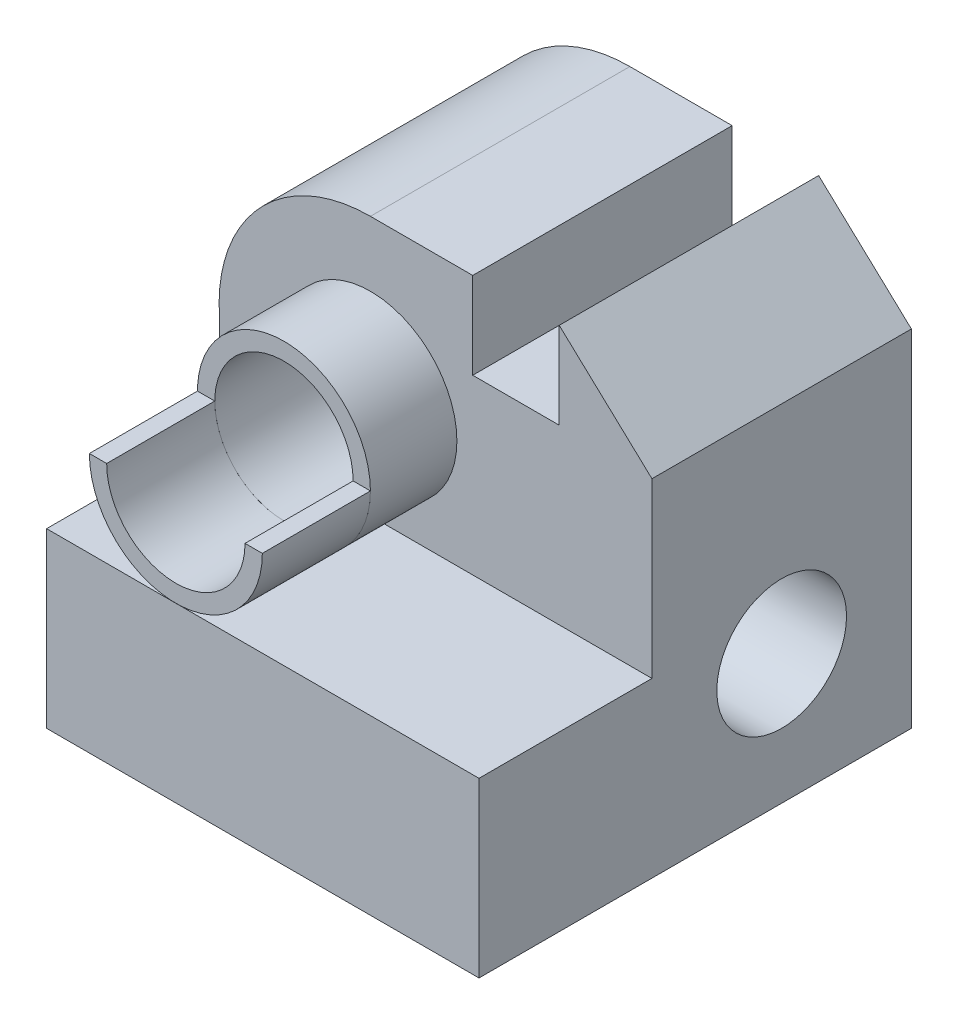
from build123d import *

# Parameters (mm, degrees)
SKETCH1_W           = 63.5
SKETCH1_H           = 25.4
BOSS_EXTRUDE1_DEPTH = 63.5
BOSS_EXTRUDE2_DEPTH = 38.1
BOSS_EXTRUDE3_DEPTH = 12.7
BOSS_EXTRUDE4_DEPTH = 15.875
SKETCH5_R           = 10.16
CUT_EXTRUDE1_DEPTH  = 84.027885603
SKETCH6_R           = 9.525
CUT_EXTRUDE2_DEPTH  = 111.026122617


with BuildPart() as part:
    # Sketch1 → Boss-Extrude1 (new body)
    with BuildSketch(Plane.XY):
        with Locations((5.796901173, 12.7)):
            Rectangle(SKETCH1_W, SKETCH1_H)
    extrude(amount=-BOSS_EXTRUDE1_DEPTH)

    # Sketch2 → Boss-Extrude2 (add)
    with BuildSketch(Plane(origin=(0, 0, -63.5), x_dir=(-1, 0, 0), z_dir=(0, 0, -1))):
        with BuildLine():
            Line((-37.546901173, 25.4), (-37.546901173, 50.8))
            Line((-37.546901173, 50.8), (-23.927818555, 63.5))
            Line((-23.927818555, 63.5), (-23.927818555, 50.8))
            Line((-23.927818555, 50.8), (-11.227818555, 50.8))
            Line((-11.227818555, 50.8), (-11.227818555, 63.5))
            Line((-11.227818555, 63.5), (3.79890705, 63.5))
            ThreePointArc((3.79890705, 63.5), (20.129071571, 56.350687438), (25.953098827, 39.502315117))
            Line((25.953098827, 39.502315117), (25.953098827, 25.4))
            Line((25.953098827, 25.4), (-37.546901173, 25.4))
        make_face()
    extrude(amount=-BOSS_EXTRUDE2_DEPTH)

    # Sketch3 → Boss-Extrude3 (add)
    with BuildSketch(Plane.XY.offset(-25.4)):
        with BuildLine():
            ThreePointArc((-13.95890705, 41.275), (-3.79890705, 51.435), (6.36109295, 41.275))
            Line((6.36109295, 41.275), (8.90109295, 41.275))
            ThreePointArc((8.90109295, 41.275), (-3.79890705, 53.975), (-16.49890705, 41.275))
            Line((-16.49890705, 41.275), (-13.95890705, 41.275))
        make_face()
        with BuildLine():
            Line((8.90109295, 41.275), (6.36109295, 41.275))
            ThreePointArc((6.36109295, 41.275), (-3.79890705, 31.115), (-13.95890705, 41.275))
            Line((-13.95890705, 41.275), (-16.49890705, 41.275))
            ThreePointArc((-16.49890705, 41.275), (-3.79890705, 28.575), (8.90109295, 41.275))
        make_face()
    extrude(amount=BOSS_EXTRUDE3_DEPTH)

    # Sketch5 → Cut-Extrude1 (cut, through all)
    with BuildSketch(Plane.XY.offset(-25.4)):
        with Locations((-3.79890705, 41.275)):
            Circle(SKETCH5_R)
    extrude(amount=-CUT_EXTRUDE1_DEPTH, mode=Mode.SUBTRACT)

    # Sketch6 → Cut-Extrude2 (cut, through all)
    with BuildSketch(Plane(origin=(37.546901173, 0, 0), x_dir=(0, 0, -1), z_dir=(1, 0, 0))):
        with Locations((44.45, 19.05)):
            Circle(SKETCH6_R)
    extrude(amount=-CUT_EXTRUDE2_DEPTH, mode=Mode.SUBTRACT)


with BuildPart() as body_2:
    # Sketch4 → Boss-Extrude4 (new body)
    with BuildSketch(Plane.XY.offset(-12.7)):
        with BuildLine():
            Line((-13.95890705, 41.275), (-16.49890705, 41.275))
            ThreePointArc((-16.49890705, 41.275), (-3.79890705, 28.575), (8.90109295, 41.275))
            Line((8.90109295, 41.275), (6.36109295, 41.275))
            ThreePointArc((6.36109295, 41.275), (-3.79890705, 31.115), (-13.95890705, 41.275))
        make_face()
    extrude(amount=BOSS_EXTRUDE4_DEPTH)


solid = Compound([part.part, body_2.part])
